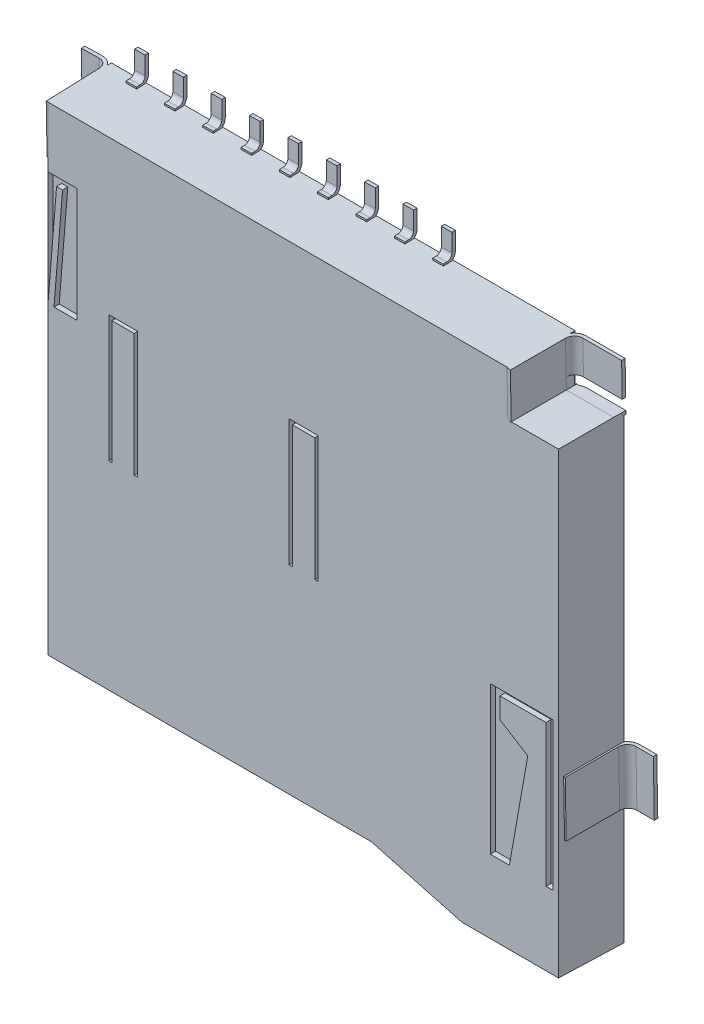
from build123d import *

# Parameters (mm, degrees)
EXTRUDE_1_DEPTH        = 1.85
EXTRUDE_1_DRAFT        = 1
EXTRUDE_2_DEPTH        = 0.7
EXTRUDE_4_DEPTH        = 0.7
EXTRUDE_5_DEPTH        = 0.8
EXTRUDE_6_DEPTH        = 0.8
EXTRUDE_7_DEPTH        = 0.15
PATTERN_LINEAR_1_COUNT = 9
PATTERN_LINEAR_1_PITCH = 1.1
SKETCH_33_W            = 11.418941433
SKETCH_33_H            = 1.155780739
CUT_EXTRUDE_5_DEPTH    = 6
SKETCH_38_W            = 1.393454766
SKETCH_38_H            = 0.329289155
CUT_EXTRUDE_11_DEPTH   = 22.42617426
SKETCH_39_R            = 0.4
EXTRUDE_2_2_DEPTH      = 0.6
SKETCH_40_R            = 0.4
EXTRUDE_4_2_DEPTH      = 0.6
CUT_EXTRUDE_12_DEPTH   = 1
CUT_EXTRUDE_13_DEPTH   = 1
CUT_EXTRUDE_14_DEPTH   = 1


with BuildPart() as part:
    # 草图1 → 凸台-拉伸1 (with draft: the straight prism first)
    with BuildSketch(Plane.XY):
        Polygon((0, 0), (0, -13.8), (9.3, -13.8), (11.9, -14.5), (14.707075074, -14.5), (14.707075074, -1.3), (13.3, -1.3), (13.3, 0), align=None)
    extrude(amount=EXTRUDE_1_DEPTH)
    # 凸台-拉伸1: the draft: its side faces are tilted about the plane it starts from
    extrude_1_sides = [part.faces().sort_by_distance(p)[0] for p in [
        (0, -6.9, 0.925),
        (4.65, -13.8, 0.925),
        (10.6, -14.15, 0.925),
        (13.303537537, -14.5, 0.925),
        (14.707075074, -7.9, 0.925),
        (14.003537537, -1.3, 0.925),
        (13.3, -0.65, 0.925),
        (6.65, 0, 0.925),
    ]]
    draft(extrude_1_sides, Plane.XY, EXTRUDE_1_DRAFT)

    # 草图17 → Extrude 2 (add, symmetric)
    with BuildSketch(Plane(origin=(0, -0.699893387, -0.012216685), x_dir=(1, 0, 0), z_dir=(0, 0.9998476951563913, 0.01745240643728355))):
        with BuildLine():
            Line((13.317700517, -1.873842423), (13.344848027, -0.318325691))
            ThreePointArc((13.344848027, -0.318325691), (13.41958241, -0.144375749), (13.594809963, -0.072688128))
            Line((13.594809963, -0.072688128), (14.707075074, -0.072688128))
            Line((14.707075074, -0.072688128), (14.707075074, 0.027311872))
            Line((14.707075074, 0.027311872), (13.594809963, 0.027311872))
            ThreePointArc((13.594809963, 0.027311872), (13.349491388, -0.073050797), (13.244863253, -0.316580716))
            Line((13.244863253, -0.316580716), (13.217715743, -1.872097448))
            Line((13.217715743, -1.872097448), (13.317700517, -1.873842423))
        make_face()
    extrude(amount=EXTRUDE_2_DEPTH, both=True)

    # 草图27 → Extrude 4 (add, symmetric)
    with BuildSketch(Plane(origin=(0, -0.699893387, -0.012216685), x_dir=(1, 0, 0), z_dir=(0, 0.9998476951563913, 0.01745240643728355))):
        with BuildLine():
            Line((0.082284257, -1.849409319), (0.055227312, -0.299081835))
            ThreePointArc((0.055227312, -0.299081835), (-0.051588299, -0.053420963), (-0.30082681, 0.044757462))
            Line((-0.30082681, 0.044757462), (-0.800915847, 0.036029705))
            Line((-0.800915847, 0.036029705), (-0.799170872, -0.063955069))
            Line((-0.799170872, -0.063955069), (-0.299081835, -0.055227312))
            ThreePointArc((-0.299081835, -0.055227312), (-0.121054327, -0.125354759), (-0.044757462, -0.30082681))
            Line((-0.044757462, -0.30082681), (-0.017700517, -1.851154294))
            Line((-0.017700517, -1.851154294), (0.082284257, -1.849409319))
        make_face()
    extrude(amount=EXTRUDE_4_DEPTH, both=True)

    # 草图28 → 拉伸-薄壁5 (add, symmetric)
    with BuildSketch(Plane(origin=(0, -10.29843126, -0.179759786), x_dir=(1, 0, 0), z_dir=(0, 0.9998476951563913, 0.01745240643728355))):
        with BuildLine():
            Line((0.032296218, -1.851725733), (0.049044716, -0.386353774))
            ThreePointArc((0.049044716, -0.386353774), (-0.036454559, -0.153112655), (-0.255189246, -0.035355776))
            Line((-0.255189246, -0.035355776), (-0.79350862, 0.035608451))
            Line((-0.79350862, 0.035608451), (-0.806578099, -0.063533814))
            Line((-0.806578099, -0.063533814), (-0.268258726, -0.134498041))
            ThreePointArc((-0.268258726, -0.134498041), (-0.112019664, -0.218610098), (-0.050948753, -0.385210897))
            Line((-0.050948753, -0.385210897), (-0.067697251, -1.850582856))
            Line((-0.067697251, -1.850582856), (0.032296218, -1.851725733))
        make_face()
    extrude(amount=EXTRUDE_5_DEPTH, both=True)

    # 草图29 → 拉伸-薄壁6 (add, symmetric)
    with BuildSketch(Plane(origin=(0, -10.29843126, -0.179759786), x_dir=(1, 0, 0), z_dir=(0, 0.9998476951563913, 0.01745240643728355))):
        with BuildLine():
            Line((14.724775162, -1.873866647), (14.751782403, -0.36820457))
            ThreePointArc((14.751782403, -0.36820457), (14.826557849, -0.1943333), (15.001742195, -0.122688128))
            Line((15.001742195, -0.122688128), (15.5, -0.122688128))
            Line((15.5, -0.122688128), (15.5, -0.022688128))
            Line((15.5, -0.022688128), (15.001742195, -0.022688128))
            ThreePointArc((15.001742195, -0.022688128), (14.75648411, -0.122991369), (14.651798486, -0.366411146))
            Line((14.651798486, -0.366411146), (14.624791245, -1.872073224))
            Line((14.624791245, -1.872073224), (14.724775162, -1.873866647))
        make_face()
    extrude(amount=EXTRUDE_6_DEPTH, both=True)

    # 草图30 → 拉伸-薄壁7 (add, symmetric)
    with BuildSketch(Plane(origin=(0.849870541, 0, -0.014834545), x_dir=(0.017452406437283557, 0, 0.9998476951563913), z_dir=(-0.9998476951563913, 0, 0.017452406437283557))):
        with BuildLine():
            Line((0.300829082, 0.044742191), (0.197374924, 0.046552968))
            ThreePointArc((0.197374924, 0.046552968), (0.093009904, 0.09139618), (0.05, 0.196529997))
            Line((0.05, 0.196529997), (0.05, 0.71))
            Line((0.05, 0.71), (-0.05, 0.71))
            Line((-0.05, 0.71), (-0.05, 0.196529997))
            ThreePointArc((-0.05, 0.196529997), (0.021683173, 0.02130697), (0.195624874, -0.053431717))
            Line((0.195624874, -0.053431717), (0.299079031, -0.055242494))
            Line((0.299079031, -0.055242494), (0.300829082, 0.044742191))
        make_face()
    extrude_7 = extrude(amount=EXTRUDE_7_DEPTH, both=True)

    # 阵列(线性)1: 拉伸-薄壁7 ×9
    with Locations(*[(i * PATTERN_LINEAR_1_PITCH, 0, 0) for i in range(1, PATTERN_LINEAR_1_COUNT)]):
        add(extrude_7)

    # 草图33 → 切除-拉伸5 (cut, symmetric)
    with BuildSketch(Plane(origin=(0, -10.29843126, -0.179759786), x_dir=(1, 0, 0), z_dir=(0, 0.9998476951563913, 0.01745240643728355))):
        with Locations((6.178470159, -1.017889651)):
            Rectangle(SKETCH_33_W, SKETCH_33_H)
    extrude(amount=CUT_EXTRUDE_5_DEPTH, both=True, mode=Mode.SUBTRACT)

    # 草图38 → 切除-拉伸11 (cut, through all)
    with BuildSketch(Plane.XY.offset(2.7)):
        with Locations((14.04157541, -1.14051501)):
            Rectangle(SKETCH_38_W, SKETCH_38_H)
    extrude(amount=-CUT_EXTRUDE_11_DEPTH, mode=Mode.SUBTRACT)

    # 草图39 → Extrude 2 2 (add)
    with BuildSketch(Plane.XY):
        with Locations((2.3, -10.5)):
            Circle(SKETCH_39_R)
    extrude(amount=-EXTRUDE_2_2_DEPTH)

    # 草图40 → Extrude 4 2 (add)
    with BuildSketch(Plane.XY):
        with Locations((10.3, -10.5)):
            Circle(SKETCH_40_R)
    extrude(amount=-EXTRUDE_4_2_DEPTH)

    # 草图41 → 切除-拉伸12 (cut)
    with BuildSketch(Plane.XY.offset(2.7)):
        Polygon((0.03229187, -1.763029962), (0.86803657, -1.763029962), (0.86803657, -5.037991608), (0.204192993, -5.037991608), (0.45016422, -2.006439273), (0.278263097, -2.006439273), (0.03229187, -5.037991608), align=None)
    extrude(amount=-CUT_EXTRUDE_12_DEPTH, mode=Mode.SUBTRACT)

    # 草图42 → 切除-拉伸13 (cut)
    with BuildSketch(Plane.XY.offset(2.7)):
        Polygon((1.775289458, -4.440532389), (1.775289458, -8.069543943), (1.866345649, -8.069543943), (1.866345649, -4.54536668), (2.501417473, -4.54536668), (2.501417473, -8.069543943), (2.592323579, -8.069543943), (2.592323579, -4.440532389), align=None)
        Polygon((6.945725437, -4.440532389), (6.945725437, -8.069543943), (7.040493303, -8.069543943), (7.040493303, -4.54536668), (7.686059009, -4.54536668), (7.686059009, -8.069543943), (7.777989016, -8.069543943), (7.777989016, -4.440532389), align=None)
    extrude(amount=-CUT_EXTRUDE_13_DEPTH, mode=Mode.SUBTRACT)

    # 草图43 → 切除-拉伸14 (cut)
    with BuildSketch(Plane.XY.offset(2.7)):
        Polygon((14.520183301, -8.13291664), (14.520183301, -12.370728925), (14.315727445, -12.370728925), (14.315727445, -8.300198704), (12.99605783, -8.300198704), (12.99605783, -8.894979376), (13.535077814, -9.229543504), (13.792789514, -9.38950249), (13.265567822, -12.370728925), (12.717254391, -12.370728925), (12.717254391, -8.13291664), align=None)
    extrude(amount=-CUT_EXTRUDE_14_DEPTH, mode=Mode.SUBTRACT)


solid = part.part
